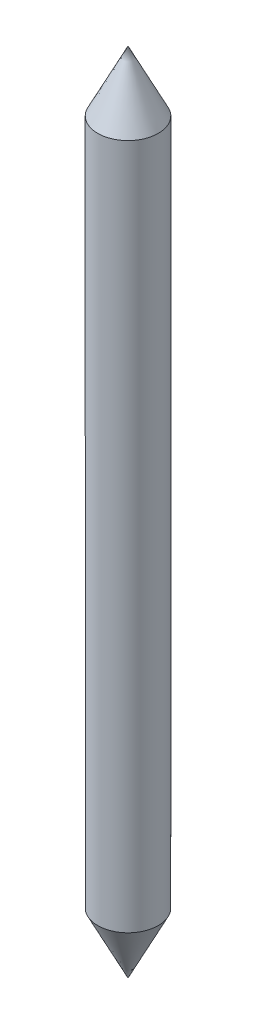
from build123d import *


with BuildPart() as part:
    # Croquis1 → Revolución1 (revolve)
    with BuildSketch(Plane.XY, mode=Mode.PRIVATE) as revoluci_n1_sk:
        Polygon((-1.868695092, 16.706266518), (-1.493695092, 17.456266518), (-1.493695092, 25.956266518), (-1.868695092, 26.706266518), align=None)
    revolve(revoluci_n1_sk.sketch.rotate(Axis((-1.868695092, 16.706266518, 0), (0, 1, 0)), 90), axis=Axis((-1.868695092, 16.706266518, 0), (0, 1, 0)))


solid = part.part
